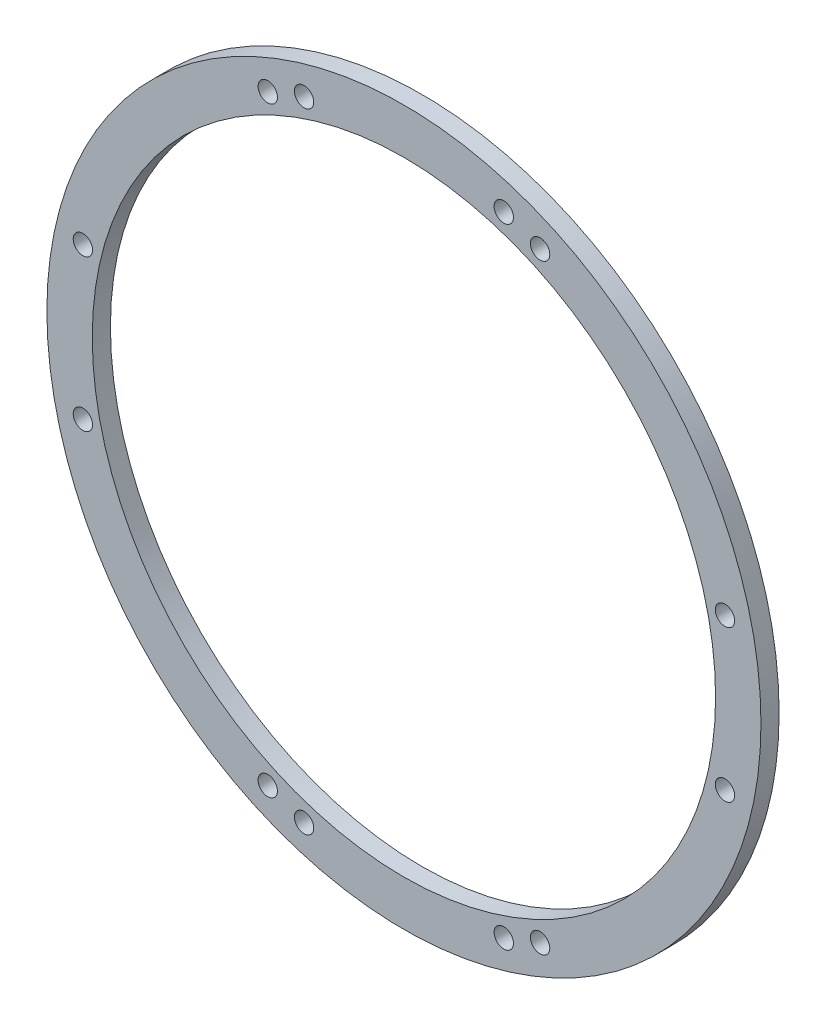
from build123d import *

# Parameters (mm, degrees)
SKETCH_1_R      = 59
SKETCH_1_R_2    = 51.5
SKETCH_1_R_3    = 1.6
EXTRUDE_1_DEPTH = 3


with BuildPart() as part:
    # 草图1 → 凸台-拉伸1 (new body)
    with BuildSketch(Plane.XY):
        Circle(SKETCH_1_R)
        Circle(SKETCH_1_R_2, mode=Mode.SUBTRACT)
        with Locations((16.5, 51.942275653)):
            Circle(SKETCH_1_R_3, mode=Mode.SUBTRACT)
        with Locations((22.5, 49.638694584)):
            Circle(SKETCH_1_R_3, mode=Mode.SUBTRACT)
        with Locations((53.047148839, 12.5)):
            Circle(SKETCH_1_R_3, mode=Mode.SUBTRACT)
        with Locations(Location((22.5, -49.638694584, 0), (0, 0, 180))):
            Circle(SKETCH_1_R_3, mode=Mode.SUBTRACT)
        with Locations(Location((16.5, -51.942275653, 0), (0, 0, 180))):
            Circle(SKETCH_1_R_3, mode=Mode.SUBTRACT)
        with Locations(Location((53.047148839, -12.5, 0), (0, 0, 180))):
            Circle(SKETCH_1_R_3, mode=Mode.SUBTRACT)
        with Locations((-16.5, -51.942275653)):
            Circle(SKETCH_1_R_3, mode=Mode.SUBTRACT)
        with Locations((-22.5, -49.638694584)):
            Circle(SKETCH_1_R_3, mode=Mode.SUBTRACT)
        with Locations((-53.047148839, -12.5)):
            Circle(SKETCH_1_R_3, mode=Mode.SUBTRACT)
        with Locations(Location((-53.047148839, 12.5, 0), (0, 0, 180))):
            Circle(SKETCH_1_R_3, mode=Mode.SUBTRACT)
        with Locations(Location((-22.5, 49.638694584, 0), (0, 0, 180))):
            Circle(SKETCH_1_R_3, mode=Mode.SUBTRACT)
        with Locations(Location((-16.5, 51.942275653, 0), (0, 0, 180))):
            Circle(SKETCH_1_R_3, mode=Mode.SUBTRACT)
    extrude(amount=EXTRUDE_1_DEPTH)


solid = part.part
